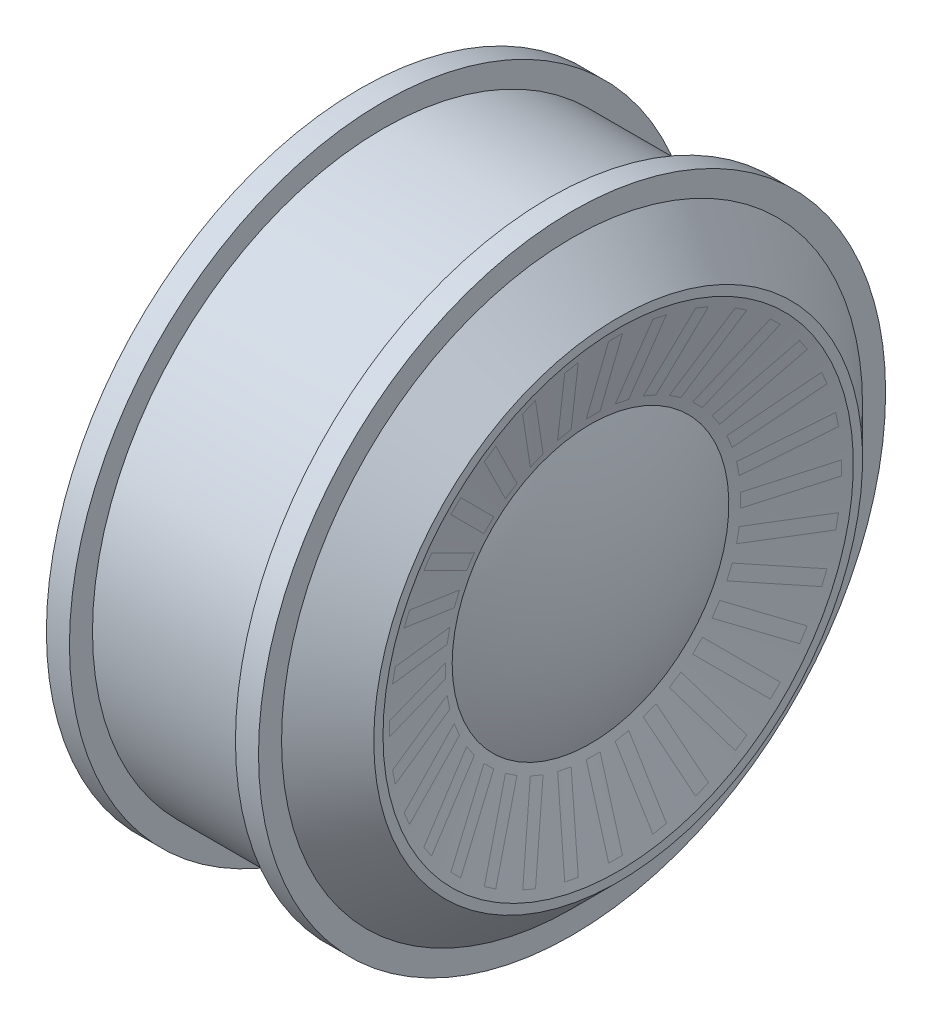
from build123d import *


with BuildPart() as part:
    # Croquis1 → Revolución1 (revolve)
    with BuildSketch(Plane.XY, mode=Mode.PRIVATE) as revoluci_n1_sk:
        with BuildLine():
            Line((-23, 68), (-18, 68))
            Line((-18, 68), (-18, 63))
            Line((-18, 63), (18, 63))
            Line((18, 63), (18, 68))
            Line((18, 68), (23, 68))
            Line((23, 68), (23, 63))
            Line((23, 63), (33, 53))
            Line((33, 53), (33, 51))
            Line((33, 51), (27, 30))
            ThreePointArc((27, 30), (31.485292704, 15.297058541), (33, 0))
            Line((33, 0), (-23, 0))
            Line((-23, 0), (-23, 8))
            Line((-23, 8), (-29, 8))
            Line((-29, 8), (-29, 16.5))
            Line((-29, 16.5), (-23, 22.5))
            Line((-23, 22.5), (-23, 68))
        make_face()
    revolve(revoluci_n1_sk.sketch.rotate(Axis((-754.889867841, 0, 0), (1, 0, 0)), 90), axis=Axis((-754.889867841, 0, 0), (1, 0, 0)))


solid = part.part
